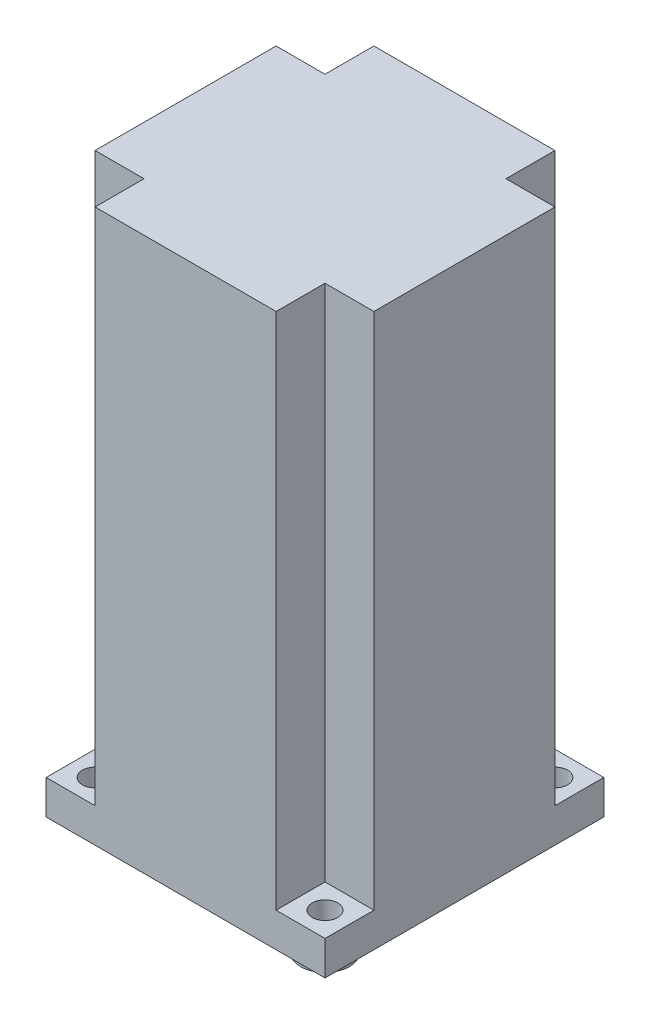
from build123d import *

# Parameters (mm, degrees)
CROQUIS1_W                   = 57
CROQUIS1_H                   = 57
SALIENTE_EXTRUIR1_DEPTH      = 113
CROQUIS2_R                   = 5
SALIENTE_EXTRUIR2_DEPTH      = 24
TALADRO_DE_MARGEN_PARA_M51_D = 5.2
CROQUIS8_W                   = 10
CROQUIS8_H                   = 10
CROQUIS8_R                   = 2.6
CORTAR_EXTRUIR1_DEPTH        = 106


with BuildPart() as part:
    # Croquis1 → Saliente-Extruir1 (new body)
    with BuildSketch(Plane(origin=(0, 0, 0), x_dir=(1, 0, 0), z_dir=(0, 1, 0))):
        Rectangle(CROQUIS1_W, CROQUIS1_H)
    extrude(amount=SALIENTE_EXTRUIR1_DEPTH)

    # Croquis2 → Saliente-Extruir2 (add)
    with BuildSketch(Plane(origin=(0, 0, 0), x_dir=(-1, 0, 0), z_dir=(0, -1, 0))):
        with Locations(Location((0, 0, 0), (0, 0, 90))):
            Circle(CROQUIS2_R)
    extrude(amount=SALIENTE_EXTRUIR2_DEPTH)

    # Taladro de margen para M51 (through all)
    with Locations(Plane(origin=(0, 0, 0), x_dir=(-1, 0, 0), z_dir=(0, -1, 0))):
        with Locations((23.5, -23.5), (-23.5, -23.5), (-23.5, 23.5), (23.5, 23.5)):
            Hole(TALADRO_DE_MARGEN_PARA_M51_D / 2)

    # Croquis8 → Cortar-Extruir1 (cut)
    # profile 1 of 6: a face of its own
    with BuildSketch(Plane(origin=(0, 113, 0), x_dir=(1, 0, 0), z_dir=(0, 1, 0))):
        with Locations((-23.5, -23.5)):
            Rectangle(CROQUIS8_W, CROQUIS8_H)
        with Locations(Location((-23.5, -23.5, 0), (0, 0, 90))):
            Circle(CROQUIS8_R, mode=Mode.SUBTRACT)
    # profile 2 of 6: a face of its own
    with BuildSketch(Plane(origin=(0, 113, 0), x_dir=(1, 0, 0), z_dir=(0, 1, 0))):
        with Locations((23.5, -23.5)):
            Rectangle(CROQUIS8_W, CROQUIS8_H)
        with Locations(Location((23.5, -23.5, 0), (0, 0, 90))):
            Circle(CROQUIS8_R, mode=Mode.SUBTRACT)
    # profile 3 of 6: a face of its own
    with BuildSketch(Plane(origin=(0, 113, 0), x_dir=(1, 0, 0), z_dir=(0, 1, 0))):
        with Locations(Location((23.5, -23.5, 0), (0, 0, 90))):
            Circle(CROQUIS8_R)
    # profile 4 of 6: a face of its own
    with BuildSketch(Plane(origin=(0, 113, 0), x_dir=(1, 0, 0), z_dir=(0, 1, 0))):
        with Locations((-23.5, 23.5)):
            Rectangle(CROQUIS8_W, CROQUIS8_H)
        with Locations(Location((-23.5, 23.5, 0), (0, 0, 90))):
            Circle(CROQUIS8_R, mode=Mode.SUBTRACT)
    # profile 5 of 6: a face of its own
    with BuildSketch(Plane(origin=(0, 113, 0), x_dir=(1, 0, 0), z_dir=(0, 1, 0))):
        with Locations(Location((-23.5, 23.5, 0), (0, 0, 90))):
            Circle(CROQUIS8_R)
    # profile 6 of 6: a face of its own
    with BuildSketch(Plane(origin=(0, 113, 0), x_dir=(1, 0, 0), z_dir=(0, 1, 0))):
        with Locations((23.5, 23.5)):
            Rectangle(CROQUIS8_W, CROQUIS8_H)
    extrude(amount=-CORTAR_EXTRUIR1_DEPTH, mode=Mode.SUBTRACT)


solid = part.part
